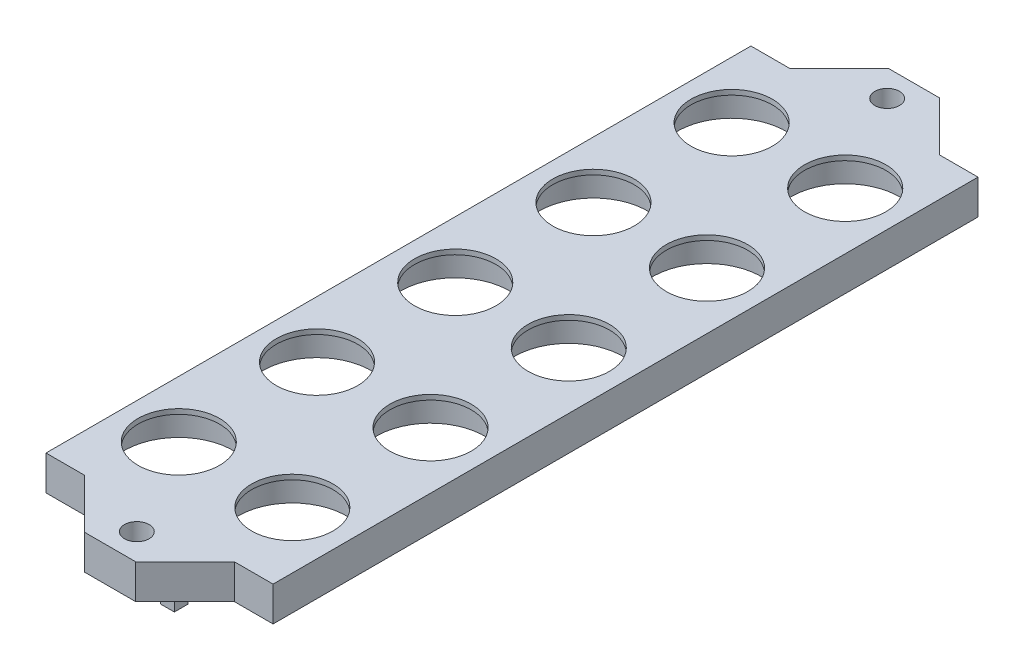
from build123d import *

# Parameters (mm, degrees)
SZKIC1_R                    = 11
SZKIC1_R_2                  = 10.6
SZKIC1_R_3                  = 10.1
SZKIC1_R_4                  = 8.25
SZKIC1_W                    = 10
SZKIC1_H                    = 10
DODANIE_WYCI_GNI_CIE1_DEPTH = 1
SZKIC1_3_R                  = 11
DODANIE_WYCI_GNI_CIE2_DEPTH = 6
SZKIC2_R                    = 2.5
WYTNIJ_WYCI_GNI_CIE1_DEPTH  = 20
DODANIE_WYCI_GNI_CIE3_DEPTH = 7
SZKIC7_W                    = 2.8
SZKIC7_H                    = 2.8
DODANIE_WYCI_GNI_CIE4_DEPTH = 3


with BuildPart() as part:
    # Szkic1 → Dodanie-wyciągnięcie1 (new body)
    # profile 1 of 43: a face of its own
    with BuildSketch(Plane(origin=(0, 0, 0), x_dir=(1, 0, 0), z_dir=(0, 1, 0))):
        Polygon((6.5, 15), (-3.5, 15), (-11.5, 15), (-11.5, -127), (-3.5, -127), (6.5, -127), (16.5, -127), (26.5, -127), (34.5, -127), (34.5, 15), (26.5, 15), (16.5, 15), align=None)
        with Locations((0, -112)):
            Circle(SZKIC1_R, mode=Mode.SUBTRACT)
        with Locations((0, -84)):
            Circle(SZKIC1_R, mode=Mode.SUBTRACT)
        with Locations((0, -56)):
            Circle(SZKIC1_R, mode=Mode.SUBTRACT)
        with Locations((23, -112)):
            Circle(SZKIC1_R, mode=Mode.SUBTRACT)
        with Locations((23, -84)):
            Circle(SZKIC1_R, mode=Mode.SUBTRACT)
        with Locations((23, -56)):
            Circle(SZKIC1_R, mode=Mode.SUBTRACT)
        with Locations((0, -28)):
            Circle(SZKIC1_R, mode=Mode.SUBTRACT)
        Circle(SZKIC1_R, mode=Mode.SUBTRACT)
        with Locations((23, -28)):
            Circle(SZKIC1_R, mode=Mode.SUBTRACT)
        with Locations((23, 0)):
            Circle(SZKIC1_R, mode=Mode.SUBTRACT)
    # profile 2 of 43: a face of its own
    with BuildSketch(Plane(origin=(0, 0, 0), x_dir=(1, 0, 0), z_dir=(0, 1, 0))):
        Polygon((6.5, 15), (-3.5, 15), (-11.5, 15), (-11.5, -127), (-3.5, -127), (6.5, -127), (16.5, -127), (26.5, -127), (34.5, -127), (34.5, 15), (26.5, 15), (16.5, 15), align=None)
        with Locations((0, -112)):
            Circle(SZKIC1_R, mode=Mode.SUBTRACT)
        with Locations((0, -84)):
            Circle(SZKIC1_R, mode=Mode.SUBTRACT)
        with Locations((0, -56)):
            Circle(SZKIC1_R, mode=Mode.SUBTRACT)
        with Locations((23, -112)):
            Circle(SZKIC1_R, mode=Mode.SUBTRACT)
        with Locations((23, -84)):
            Circle(SZKIC1_R, mode=Mode.SUBTRACT)
        with Locations((23, -56)):
            Circle(SZKIC1_R, mode=Mode.SUBTRACT)
        with Locations((0, -28)):
            Circle(SZKIC1_R, mode=Mode.SUBTRACT)
        Circle(SZKIC1_R, mode=Mode.SUBTRACT)
        with Locations((23, -28)):
            Circle(SZKIC1_R, mode=Mode.SUBTRACT)
        with Locations((23, 0)):
            Circle(SZKIC1_R, mode=Mode.SUBTRACT)
    # profile 3 of 43: a face of its own
    with BuildSketch(Plane(origin=(0, 0, 0), x_dir=(1, 0, 0), z_dir=(0, 1, 0))):
        Polygon((6.5, 15), (-3.5, 15), (-11.5, 15), (-11.5, -127), (-3.5, -127), (6.5, -127), (16.5, -127), (26.5, -127), (34.5, -127), (34.5, 15), (26.5, 15), (16.5, 15), align=None)
        with Locations((0, -112)):
            Circle(SZKIC1_R, mode=Mode.SUBTRACT)
        with Locations((0, -84)):
            Circle(SZKIC1_R, mode=Mode.SUBTRACT)
        with Locations((0, -56)):
            Circle(SZKIC1_R, mode=Mode.SUBTRACT)
        with Locations((23, -112)):
            Circle(SZKIC1_R, mode=Mode.SUBTRACT)
        with Locations((23, -84)):
            Circle(SZKIC1_R, mode=Mode.SUBTRACT)
        with Locations((23, -56)):
            Circle(SZKIC1_R, mode=Mode.SUBTRACT)
        with Locations((0, -28)):
            Circle(SZKIC1_R, mode=Mode.SUBTRACT)
        Circle(SZKIC1_R, mode=Mode.SUBTRACT)
        with Locations((23, -28)):
            Circle(SZKIC1_R, mode=Mode.SUBTRACT)
        with Locations((23, 0)):
            Circle(SZKIC1_R, mode=Mode.SUBTRACT)
    # profile 4 of 43: a face of its own
    with BuildSketch(Plane(origin=(0, 0, 0), x_dir=(1, 0, 0), z_dir=(0, 1, 0))):
        with Locations((0, -28)):
            Circle(SZKIC1_R)
        with Locations((0, -28)):
            Circle(SZKIC1_R_2, mode=Mode.SUBTRACT)
    # profile 5 of 43: a face of its own
    with BuildSketch(Plane(origin=(0, 0, 0), x_dir=(1, 0, 0), z_dir=(0, 1, 0))):
        with Locations((0, -28)):
            Circle(SZKIC1_R)
        with Locations((0, -28)):
            Circle(SZKIC1_R_2, mode=Mode.SUBTRACT)
    # profile 6 of 43: a face of its own
    with BuildSketch(Plane(origin=(0, 0, 0), x_dir=(1, 0, 0), z_dir=(0, 1, 0))):
        with Locations((0, -28)):
            Circle(SZKIC1_R_2)
        with Locations((0, -28)):
            Circle(SZKIC1_R_3, mode=Mode.SUBTRACT)
    # profile 7 of 43: a face of its own
    with BuildSketch(Plane(origin=(0, 0, 0), x_dir=(1, 0, 0), z_dir=(0, 1, 0))):
        with Locations((0, -28)):
            Circle(SZKIC1_R_3)
        with Locations(Location((0, -28, 0), (0, 0, 270))):
            Circle(SZKIC1_R_4, mode=Mode.SUBTRACT)
    # profile 8 of 43: a face of its own
    with BuildSketch(Plane(origin=(0, 0, 0), x_dir=(1, 0, 0), z_dir=(0, 1, 0))):
        with Locations((23, -28)):
            Circle(SZKIC1_R)
        with Locations((23, -28)):
            Circle(SZKIC1_R_2, mode=Mode.SUBTRACT)
    # profile 9 of 43: a face of its own
    with BuildSketch(Plane(origin=(0, 0, 0), x_dir=(1, 0, 0), z_dir=(0, 1, 0))):
        with Locations((23, -28)):
            Circle(SZKIC1_R)
        with Locations((23, -28)):
            Circle(SZKIC1_R_2, mode=Mode.SUBTRACT)
    # profile 10 of 43: a face of its own
    with BuildSketch(Plane(origin=(0, 0, 0), x_dir=(1, 0, 0), z_dir=(0, 1, 0))):
        with Locations((23, -28)):
            Circle(SZKIC1_R_2)
        with Locations((23, -28)):
            Circle(SZKIC1_R_3, mode=Mode.SUBTRACT)
    # profile 11 of 43: a face of its own
    with BuildSketch(Plane(origin=(0, 0, 0), x_dir=(1, 0, 0), z_dir=(0, 1, 0))):
        with Locations((23, -28)):
            Circle(SZKIC1_R_3)
        with Locations(Location((23, -28, 0), (0, 0, 270))):
            Circle(SZKIC1_R_4, mode=Mode.SUBTRACT)
    # profile 12 of 43: a face of its own
    with BuildSketch(Plane(origin=(0, 0, 0), x_dir=(1, 0, 0), z_dir=(0, 1, 0))):
        with Locations((23, 0)):
            Circle(SZKIC1_R)
        with Locations((23, 0)):
            Circle(SZKIC1_R_2, mode=Mode.SUBTRACT)
    # profile 13 of 43: a face of its own
    with BuildSketch(Plane(origin=(0, 0, 0), x_dir=(1, 0, 0), z_dir=(0, 1, 0))):
        with Locations((23, 0)):
            Circle(SZKIC1_R)
        with Locations((23, 0)):
            Circle(SZKIC1_R_2, mode=Mode.SUBTRACT)
    # profile 14 of 43: a face of its own
    with BuildSketch(Plane(origin=(0, 0, 0), x_dir=(1, 0, 0), z_dir=(0, 1, 0))):
        with Locations((23, 0)):
            Circle(SZKIC1_R_2)
        with Locations((23, 0)):
            Circle(SZKIC1_R_3, mode=Mode.SUBTRACT)
    # profile 15 of 43: a face of its own
    with BuildSketch(Plane(origin=(0, 0, 0), x_dir=(1, 0, 0), z_dir=(0, 1, 0))):
        with Locations((23, 0)):
            Circle(SZKIC1_R_3)
        with Locations(Location((23, 0, 0), (0, 0, 270))):
            Circle(SZKIC1_R_4, mode=Mode.SUBTRACT)
    # profile 16 of 43: a face of its own
    with BuildSketch(Plane(origin=(0, 0, 0), x_dir=(1, 0, 0), z_dir=(0, 1, 0))):
        Circle(SZKIC1_R)
        Circle(SZKIC1_R_2, mode=Mode.SUBTRACT)
    # profile 17 of 43: a face of its own
    with BuildSketch(Plane(origin=(0, 0, 0), x_dir=(1, 0, 0), z_dir=(0, 1, 0))):
        Circle(SZKIC1_R)
        Circle(SZKIC1_R_2, mode=Mode.SUBTRACT)
    # profile 18 of 43: a face of its own
    with BuildSketch(Plane(origin=(0, 0, 0), x_dir=(1, 0, 0), z_dir=(0, 1, 0))):
        Circle(SZKIC1_R_2)
        Circle(SZKIC1_R_3, mode=Mode.SUBTRACT)
    # profile 19 of 43: a face of its own
    with BuildSketch(Plane(origin=(0, 0, 0), x_dir=(1, 0, 0), z_dir=(0, 1, 0))):
        Circle(SZKIC1_R_3)
        with Locations(Location((0, 0, 0), (0, 0, 270))):
            Circle(SZKIC1_R_4, mode=Mode.SUBTRACT)
    # profile 20 of 43: a face of its own
    with BuildSketch(Plane(origin=(0, 0, 0), x_dir=(1, 0, 0), z_dir=(0, 1, 0))):
        Polygon((6.5, 15), (6.5, 25), (-3.5, 15), align=None)
    # profile 21 of 43: a face of its own
    with BuildSketch(Plane(origin=(0, 0, 0), x_dir=(1, 0, 0), z_dir=(0, 1, 0))):
        with Locations((11.5, 20)):
            Rectangle(SZKIC1_W, SZKIC1_H)
    # profile 22 of 43: a face of its own
    with BuildSketch(Plane(origin=(0, 0, 0), x_dir=(1, 0, 0), z_dir=(0, 1, 0))):
        Polygon((26.5, 15), (16.5, 25), (16.5, 15), align=None)
    # profile 23 of 43: a face of its own
    with BuildSketch(Plane(origin=(0, 0, 0), x_dir=(1, 0, 0), z_dir=(0, 1, 0))):
        with Locations((0, -56)):
            Circle(SZKIC1_R)
        with Locations((0, -56)):
            Circle(SZKIC1_R_2, mode=Mode.SUBTRACT)
    # profile 24 of 43: a face of its own
    with BuildSketch(Plane(origin=(0, 0, 0), x_dir=(1, 0, 0), z_dir=(0, 1, 0))):
        with Locations((0, -56)):
            Circle(SZKIC1_R_2)
        with Locations((0, -56)):
            Circle(SZKIC1_R_3, mode=Mode.SUBTRACT)
    # profile 25 of 43: a face of its own
    with BuildSketch(Plane(origin=(0, 0, 0), x_dir=(1, 0, 0), z_dir=(0, 1, 0))):
        with Locations((0, -56)):
            Circle(SZKIC1_R_3)
        with Locations(Location((0, -56, 0), (0, 0, 270))):
            Circle(SZKIC1_R_4, mode=Mode.SUBTRACT)
    # profile 26 of 43: a face of its own
    with BuildSketch(Plane(origin=(0, 0, 0), x_dir=(1, 0, 0), z_dir=(0, 1, 0))):
        with Locations((23, -56)):
            Circle(SZKIC1_R)
        with Locations((23, -56)):
            Circle(SZKIC1_R_2, mode=Mode.SUBTRACT)
    # profile 27 of 43: a face of its own
    with BuildSketch(Plane(origin=(0, 0, 0), x_dir=(1, 0, 0), z_dir=(0, 1, 0))):
        with Locations((23, -56)):
            Circle(SZKIC1_R_2)
        with Locations((23, -56)):
            Circle(SZKIC1_R_3, mode=Mode.SUBTRACT)
    # profile 28 of 43: a face of its own
    with BuildSketch(Plane(origin=(0, 0, 0), x_dir=(1, 0, 0), z_dir=(0, 1, 0))):
        with Locations((23, -56)):
            Circle(SZKIC1_R_3)
        with Locations(Location((23, -56, 0), (0, 0, 270))):
            Circle(SZKIC1_R_4, mode=Mode.SUBTRACT)
    # profile 29 of 43: a face of its own
    with BuildSketch(Plane(origin=(0, 0, 0), x_dir=(1, 0, 0), z_dir=(0, 1, 0))):
        with Locations((23, -84)):
            Circle(SZKIC1_R)
        with Locations((23, -84)):
            Circle(SZKIC1_R_2, mode=Mode.SUBTRACT)
    # profile 30 of 43: a face of its own
    with BuildSketch(Plane(origin=(0, 0, 0), x_dir=(1, 0, 0), z_dir=(0, 1, 0))):
        with Locations((23, -84)):
            Circle(SZKIC1_R_2)
        with Locations((23, -84)):
            Circle(SZKIC1_R_3, mode=Mode.SUBTRACT)
    # profile 31 of 43: a face of its own
    with BuildSketch(Plane(origin=(0, 0, 0), x_dir=(1, 0, 0), z_dir=(0, 1, 0))):
        with Locations((23, -84)):
            Circle(SZKIC1_R_3)
        with Locations(Location((23, -84, 0), (0, 0, 270))):
            Circle(SZKIC1_R_4, mode=Mode.SUBTRACT)
    # profile 32 of 43: a face of its own
    with BuildSketch(Plane(origin=(0, 0, 0), x_dir=(1, 0, 0), z_dir=(0, 1, 0))):
        with Locations((0, -84)):
            Circle(SZKIC1_R)
        with Locations((0, -84)):
            Circle(SZKIC1_R_2, mode=Mode.SUBTRACT)
    # profile 33 of 43: a face of its own
    with BuildSketch(Plane(origin=(0, 0, 0), x_dir=(1, 0, 0), z_dir=(0, 1, 0))):
        with Locations((0, -84)):
            Circle(SZKIC1_R_2)
        with Locations((0, -84)):
            Circle(SZKIC1_R_3, mode=Mode.SUBTRACT)
    # profile 34 of 43: a face of its own
    with BuildSketch(Plane(origin=(0, 0, 0), x_dir=(1, 0, 0), z_dir=(0, 1, 0))):
        with Locations((0, -84)):
            Circle(SZKIC1_R_3)
        with Locations(Location((0, -84, 0), (0, 0, 270))):
            Circle(SZKIC1_R_4, mode=Mode.SUBTRACT)
    # profile 35 of 43: a face of its own
    with BuildSketch(Plane(origin=(0, 0, 0), x_dir=(1, 0, 0), z_dir=(0, 1, 0))):
        with Locations((23, -112)):
            Circle(SZKIC1_R)
        with Locations((23, -112)):
            Circle(SZKIC1_R_2, mode=Mode.SUBTRACT)
    # profile 36 of 43: a face of its own
    with BuildSketch(Plane(origin=(0, 0, 0), x_dir=(1, 0, 0), z_dir=(0, 1, 0))):
        with Locations((23, -112)):
            Circle(SZKIC1_R_2)
        with Locations((23, -112)):
            Circle(SZKIC1_R_3, mode=Mode.SUBTRACT)
    # profile 37 of 43: a face of its own
    with BuildSketch(Plane(origin=(0, 0, 0), x_dir=(1, 0, 0), z_dir=(0, 1, 0))):
        with Locations((23, -112)):
            Circle(SZKIC1_R_3)
        with Locations(Location((23, -112, 0), (0, 0, 270))):
            Circle(SZKIC1_R_4, mode=Mode.SUBTRACT)
    # profile 38 of 43: a face of its own
    with BuildSketch(Plane(origin=(0, 0, 0), x_dir=(1, 0, 0), z_dir=(0, 1, 0))):
        with Locations((0, -112)):
            Circle(SZKIC1_R)
        with Locations((0, -112)):
            Circle(SZKIC1_R_2, mode=Mode.SUBTRACT)
    # profile 39 of 43: a face of its own
    with BuildSketch(Plane(origin=(0, 0, 0), x_dir=(1, 0, 0), z_dir=(0, 1, 0))):
        with Locations((0, -112)):
            Circle(SZKIC1_R_2)
        with Locations((0, -112)):
            Circle(SZKIC1_R_3, mode=Mode.SUBTRACT)
    # profile 40 of 43: a face of its own
    with BuildSketch(Plane(origin=(0, 0, 0), x_dir=(1, 0, 0), z_dir=(0, 1, 0))):
        with Locations((0, -112)):
            Circle(SZKIC1_R_3)
        with Locations(Location((0, -112, 0), (0, 0, 270))):
            Circle(SZKIC1_R_4, mode=Mode.SUBTRACT)
    # profile 41 of 43: a face of its own
    with BuildSketch(Plane(origin=(0, 0, 0), x_dir=(1, 0, 0), z_dir=(0, 1, 0))):
        with Locations((11.5, -132)):
            Rectangle(SZKIC1_W, SZKIC1_H)
    # profile 42 of 43: a face of its own
    with BuildSketch(Plane(origin=(0, 0, 0), x_dir=(1, 0, 0), z_dir=(0, 1, 0))):
        Polygon((6.5, -127), (-3.5, -127), (6.5, -137), align=None)
    # profile 43 of 43: a face of its own
    with BuildSketch(Plane(origin=(0, 0, 0), x_dir=(1, 0, 0), z_dir=(0, 1, 0))):
        Polygon((16.5, -137), (26.5, -127), (16.5, -127), align=None)
    extrude(amount=DODANIE_WYCI_GNI_CIE1_DEPTH)

    # Szkic1<3> → Dodanie-wyciągnięcie2 (add)
    with BuildSketch(Plane(origin=(0, 0, 0), x_dir=(1, 0, 0), z_dir=(0, 1, 0))):
        Polygon((16.5, 25), (6.5, 25), (-3.5, 15), (-11.5, 15), (-11.5, -127), (-3.5, -127), (6.5, -137), (16.5, -137), (26.5, -127), (34.5, -127), (34.5, 15), (26.5, 15), align=None)
        with Locations(Location((23, 0, 0), (0, 0, 270))):
            Circle(SZKIC1_3_R, mode=Mode.SUBTRACT)
        with Locations(Location((23, -28, 0), (0, 0, 270))):
            Circle(SZKIC1_3_R, mode=Mode.SUBTRACT)
        with Locations(Location((0, -112, 0), (0, 0, 270))):
            Circle(SZKIC1_3_R, mode=Mode.SUBTRACT)
        with Locations(Location((0, -84, 0), (0, 0, 270))):
            Circle(SZKIC1_3_R, mode=Mode.SUBTRACT)
        with Locations(Location((0, -56, 0), (0, 0, 270))):
            Circle(SZKIC1_3_R, mode=Mode.SUBTRACT)
        with Locations(Location((23, -112, 0), (0, 0, 270))):
            Circle(SZKIC1_3_R, mode=Mode.SUBTRACT)
        with Locations(Location((23, -84, 0), (0, 0, 270))):
            Circle(SZKIC1_3_R, mode=Mode.SUBTRACT)
        with Locations(Location((23, -56, 0), (0, 0, 270))):
            Circle(SZKIC1_3_R, mode=Mode.SUBTRACT)
        with Locations(Location((0, -28, 0), (0, 0, 270))):
            Circle(SZKIC1_3_R, mode=Mode.SUBTRACT)
        with Locations(Location((0, 0, 0), (0, 0, 270))):
            Circle(SZKIC1_3_R, mode=Mode.SUBTRACT)
    extrude(amount=-DODANIE_WYCI_GNI_CIE2_DEPTH)

    # Szkic2 → Wytnij-wyciągnięcie1 (cut)
    with BuildSketch(Plane(origin=(0, 1, 0), x_dir=(1, 0, 0), z_dir=(0, 1, 0))):
        with BuildLine():
            ThreePointArc((11.5, 22.5), (9, 20), (11.5, 17.5))
            Line((11.5, 17.5), (11.5, 22.5))
        make_face()
        with BuildLine():
            Line((11.5, 22.5), (11.5, 17.5))
            ThreePointArc((11.5, 17.5), (13.267766953, 18.232233047), (14, 20))
            ThreePointArc((14, 20), (13.267766953, 21.767766953), (11.5, 22.5))
        make_face()
        with Locations(Location((11.5, -132, 0), (0, 0, 270))):
            Circle(SZKIC2_R)
    extrude(amount=-WYTNIJ_WYCI_GNI_CIE1_DEPTH, mode=Mode.SUBTRACT)

    # Szkic6 → Dodanie-wyciągnięcie3 (add)
    with BuildSketch(Plane(origin=(0, 1, 0), x_dir=(1, 0, 0), z_dir=(0, 1, 0))):
        Polygon((-3.5, 15), (6.5, 25), (16.5, 25), (26.5, 15), (34.5, 15), (34.5, 15.4), (26.665685425, 15.4), (16.665685425, 25.4), (6.334314575, 25.4), (-3.665685425, 15.4), (-11.5, 15.4), (-11.5, 15), align=None)
        Polygon((-11.5, -127.4), (-11.5, -127), (-3.5, -127), (6.5, -137), (16.5, -137), (26.5, -127), (34.5, -127), (34.5, -127.4), (26.665685425, -127.4), (16.665685425, -137.4), (6.334314575, -137.4), (-3.665685425, -127.4), align=None)
    extrude(amount=-DODANIE_WYCI_GNI_CIE3_DEPTH)

    # Szkic7 → Dodanie-wyciągnięcie4 (add)
    with BuildSketch(Plane.XZ.offset(6)):
        with Locations((18, -18.9)):
            Rectangle(SZKIC7_W, SZKIC7_H)
        with Locations((5, -18.9)):
            Rectangle(SZKIC7_W, SZKIC7_H)
        with Locations((18, 130.9)):
            Rectangle(SZKIC7_W, SZKIC7_H)
        with Locations((5, 130.9)):
            Rectangle(SZKIC7_W, SZKIC7_H)
    extrude(amount=DODANIE_WYCI_GNI_CIE4_DEPTH)


solid = part.part
